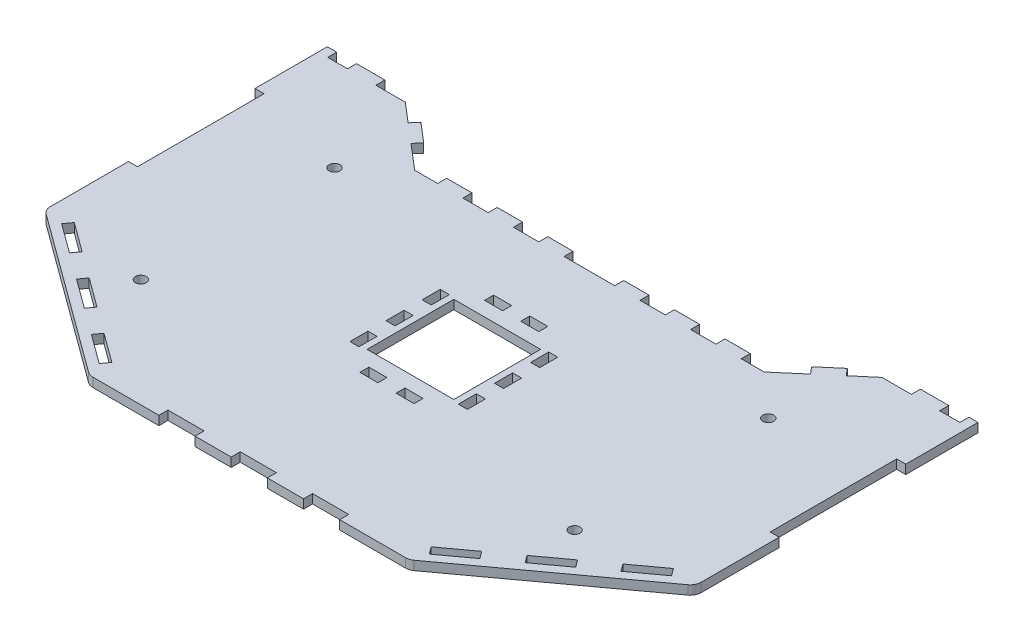
from build123d import *

# Parameters (mm, degrees)
SKETCH1_R           = 1.5
SKETCH1_W           = 5
SKETCH1_H           = 2.5
SKETCH1_W_2         = 2.5
SKETCH1_H_2         = 5
SKETCH1_W_3         = 24
SKETCH1_H_3         = 24
BOSS_EXTRUDE1_DEPTH = 2.5
FILLET1_R           = 3


with BuildPart() as part:
    # Sketch1 → Boss-Extrude1 (new body)
    with BuildSketch(Plane(origin=(0, 0, 0), x_dir=(1, 0, 0), z_dir=(0, 1, 0))):
        Polygon((42, 82.5), (42, 85), (35, 85), (35, 82.5), (28, 82.5), (28, 85), (21, 85), (21, 82.5), (14, 82.5), (14, 85), (7, 85), (7, 82.5), (-7, 82.5), (-7, 85), (-14, 85), (-14, 82.5), (-21, 82.5), (-21, 85), (-28, 85), (-28, 82.5), (-35, 82.5), (-35, 85), (-42, 85), (-42, 82.5), (-48.324658201, 82.5), (-55.266711269, 88.417765861), (-53.644883744, 90.320310336), (-58.972008275, 94.861427406), (-60.5938358, 92.958882931), (-65.92096033, 97.5), (-74.067282979, 97.5), (-74.067282979, 100), (-81.9, 100), (-81.9, 97.5), (-87.4, 97.5), (-87.4, 100), (-90, 100), (-90, 80), (-87.5, 80), (-87.5, 45), (-90, 45), (-90, 21.902362465), (-44.23398473, -11.580641316), (-25, -11.580641316), (-25, -9.080641316), (-15, -9.080641316), (-15, -11.580641316), (-5, -11.580641316), (-5, -9.080641316), (5, -9.080641316), (5, -11.580641316), (15, -11.580641316), (15, -9.080641316), (25, -9.080641316), (25, -11.580641316), (44.23398473, -11.580641316), (90, 21.902362465), (90, 45), (87.5, 45), (87.5, 80), (90, 80), (90, 100), (87.5, 100), (87.5, 97.5), (81.9, 97.5), (81.9, 100), (74.067282979, 100), (74.067282979, 97.5), (65.92096033, 97.5), (60.593835799, 92.958882931), (58.972008275, 94.861427406), (53.644883744, 90.320310336), (55.266711269, 88.417765861), (48.324658201, 82.5), align=None)
        Polygon((82.872162523, 22.882820213), (84.348313336, 20.865153546), (76.277646669, 14.960550296), (74.801495856, 16.978216962), align=None, mode=Mode.SUBTRACT)
        Polygon((67.558072522, 11.678835545), (69.034223335, 9.661168878), (60.963556668, 3.756565627), (59.487405855, 5.774232294), align=None, mode=Mode.SUBTRACT)
        Polygon((52.243982521, 0.474850877), (53.720133334, -1.54281579), (45.649466667, -7.447419041), (44.173315854, -5.429752374), align=None, mode=Mode.SUBTRACT)
        Polygon((-52.243982521, 0.474850877), (-44.173315854, -5.429752374), (-45.649466667, -7.447419041), (-53.720133334, -1.54281579), align=None, mode=Mode.SUBTRACT)
        Polygon((-59.487405855, 5.774232294), (-60.963556668, 3.756565627), (-69.034223335, 9.661168878), (-67.558072522, 11.678835545), align=None, mode=Mode.SUBTRACT)
        Polygon((-74.801495856, 16.978216962), (-76.277646669, 14.960550296), (-84.348313336, 20.865153546), (-82.872162523, 22.882820213), align=None, mode=Mode.SUBTRACT)
        with Locations(Location((-60, 18.419358684, 0), (0, 0, 270))):
            Circle(SKETCH1_R, mode=Mode.SUBTRACT)
        with Locations((-5, 27.75)):
            Rectangle(SKETCH1_W, SKETCH1_H, mode=Mode.SUBTRACT)
        with Locations((-15, 35)):
            Rectangle(SKETCH1_W_2, SKETCH1_H_2, mode=Mode.SUBTRACT)
        with Locations((5, 27.75)):
            Rectangle(SKETCH1_W, SKETCH1_H, mode=Mode.SUBTRACT)
        with Locations((15, 35)):
            Rectangle(SKETCH1_W_2, SKETCH1_H_2, mode=Mode.SUBTRACT)
        with Locations(Location((60, 18.419358684, 0), (0, 0, 270))):
            Circle(SKETCH1_R, mode=Mode.SUBTRACT)
        with Locations(Location((-60, 72, 0), (0, 0, 270))):
            Circle(SKETCH1_R, mode=Mode.SUBTRACT)
        with Locations((-15, 45)):
            Rectangle(SKETCH1_W_2, SKETCH1_H_2, mode=Mode.SUBTRACT)
        with Locations((-15, 55)):
            Rectangle(SKETCH1_W_2, SKETCH1_H_2, mode=Mode.SUBTRACT)
        with Locations((-5, 62.25)):
            Rectangle(SKETCH1_W, SKETCH1_H, mode=Mode.SUBTRACT)
        with Locations((0, 45)):
            Rectangle(SKETCH1_W_3, SKETCH1_H_3, mode=Mode.SUBTRACT)
        with Locations((15, 45)):
            Rectangle(SKETCH1_W_2, SKETCH1_H_2, mode=Mode.SUBTRACT)
        with Locations((15, 55)):
            Rectangle(SKETCH1_W_2, SKETCH1_H_2, mode=Mode.SUBTRACT)
        with Locations((5, 62.25)):
            Rectangle(SKETCH1_W, SKETCH1_H, mode=Mode.SUBTRACT)
        with Locations(Location((60, 72, 0), (0, 0, 270))):
            Circle(SKETCH1_R, mode=Mode.SUBTRACT)
    extrude(amount=BOSS_EXTRUDE1_DEPTH)

    # Fillet1
    fillet1_edges = [part.edges().sort_by_distance(p)[0] for p in [
        (90, 1.25, -21.902362465),
        (44.23398473, 1.25, 11.580641316),
        (-44.23398473, 1.25, 11.580641316),
        (-90, 1.25, -21.902362465),
    ]]
    fillet(fillet1_edges, radius=FILLET1_R)


solid = part.part
